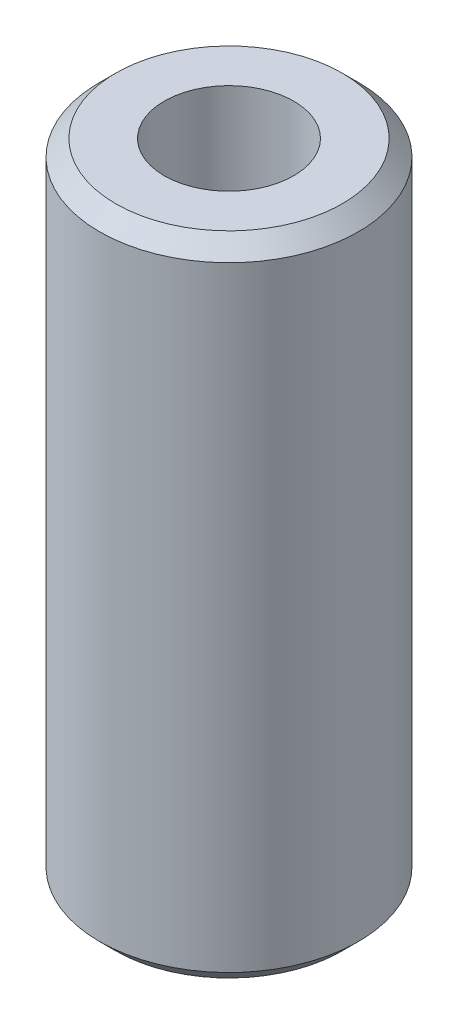
from build123d import *

# Parameters (mm, degrees)
SKETCH1_R           = 4
SKETCH1_R_2         = 2
BOSS_EXTRUDE1_DEPTH = 20
CHAMFER1_SIZE       = 0.5


with BuildPart() as part:
    # Sketch1 → Boss-Extrude1 (new body)
    with BuildSketch(Plane(origin=(0, 0, 0), x_dir=(1, 0, 0), z_dir=(0, 1, 0))):
        with Locations(Location((0, 0, 0), (0, 0, 270))):
            Circle(SKETCH1_R)
        with Locations(Location((0, 0, 0), (0, 0, 270))):
            Circle(SKETCH1_R_2, mode=Mode.SUBTRACT)
    extrude(amount=BOSS_EXTRUDE1_DEPTH)

    # Chamfer1
    chamfer1_edges = [part.edges().sort_by_distance(p)[0] for p in [
        (0, 0, -4),
        (0, 20, -4),
    ]]
    chamfer(chamfer1_edges, length=CHAMFER1_SIZE)


solid = part.part
